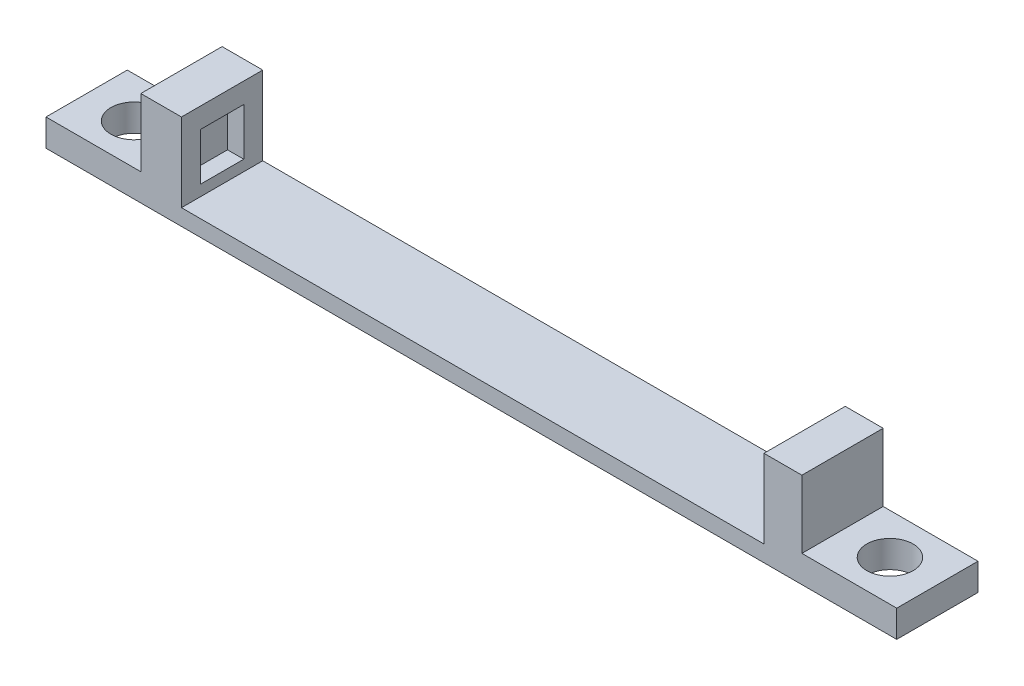
from build123d import *

# Parameters (mm, degrees)
SKETCH1_W           = 79.756
SKETCH1_H           = 7.62
BOSS_EXTRUDE1_DEPTH = 8.89
SKETCH2_W           = 8.89
SKETCH2_H           = 7.62
CUT_EXTRUDE1_DEPTH  = 6.35
SKETCH3_W           = 8.89
SKETCH3_H           = 7.62
CUT_EXTRUDE2_DEPTH  = 6.35
SKETCH4_W           = 54.61
SKETCH4_H           = 7.62
CUT_EXTRUDE3_DEPTH  = 7.366
SKETCH5_W           = 4.064
SKETCH5_H           = 4.445
CUT_EXTRUDE4_DEPTH  = 1.524
SKETCH7_W           = 3.683
SKETCH7_H           = 4.445
BOSS_EXTRUDE2_DEPTH = 1.524
SKETCH8_R           = 2.1717
CUT_EXTRUDE5_DEPTH  = 2.54
SKETCH9_R           = 2.1717
CUT_EXTRUDE6_DEPTH  = 2.54


with BuildPart() as part:
    # Sketch1 → Boss-Extrude1 (new body)
    with BuildSketch(Plane(origin=(0, 0, 0), x_dir=(1, 0, 0), z_dir=(0, 1, 0))):
        with Locations((25.937163647, -9.682646588)):
            Rectangle(SKETCH1_W, SKETCH1_H)
    extrude(amount=BOSS_EXTRUDE1_DEPTH)

    # Sketch2 → Cut-Extrude1 (cut)
    with BuildSketch(Plane(origin=(0, 8.89, 0), x_dir=(1, 0, 0), z_dir=(0, 1, 0))):
        with Locations((-9.495836353, -9.682646588)):
            Rectangle(SKETCH2_W, SKETCH2_H)
    extrude(amount=-CUT_EXTRUDE1_DEPTH, mode=Mode.SUBTRACT)

    # Sketch3 → Cut-Extrude2 (cut)
    with BuildSketch(Plane(origin=(0, 8.89, 0), x_dir=(1, 0, 0), z_dir=(0, 1, 0))):
        with Locations((61.370163647, -9.682646588)):
            Rectangle(SKETCH3_W, SKETCH3_H)
    extrude(amount=-CUT_EXTRUDE2_DEPTH, mode=Mode.SUBTRACT)

    # Sketch4 → Cut-Extrude3 (cut)
    with BuildSketch(Plane(origin=(0, 8.89, 0), x_dir=(1, 0, 0), z_dir=(0, 1, 0))):
        with Locations((26.064163647, -9.682646588)):
            Rectangle(SKETCH4_W, SKETCH4_H)
    extrude(amount=-CUT_EXTRUDE3_DEPTH, mode=Mode.SUBTRACT)

    # Sketch5 → Cut-Extrude4 (cut)
    with BuildSketch(Plane(origin=(-1.240836353, 0, 0), x_dir=(0, 0, -1), z_dir=(1, 0, 0))):
        with Locations((-9.682646588, 4.7625)):
            Rectangle(SKETCH5_W, SKETCH5_H)
    extrude(amount=-CUT_EXTRUDE4_DEPTH, mode=Mode.SUBTRACT)

    # Sketch7 → Boss-Extrude2 (add)
    with BuildSketch(Plane.ZY.offset(-53.369163647)):
        with Locations((9.682646588, 4.7625)):
            Rectangle(SKETCH7_W, SKETCH7_H)
    extrude(amount=BOSS_EXTRUDE2_DEPTH)

    # Sketch8 → Cut-Extrude5 (cut)
    with BuildSketch(Plane(origin=(0, 2.54, 0), x_dir=(1, 0, 0), z_dir=(0, 1, 0))):
        with Locations(Location((-9.495836353, -9.682646588, 0), (0, 0, 270))):
            Circle(SKETCH8_R)
    extrude(amount=-CUT_EXTRUDE5_DEPTH, mode=Mode.SUBTRACT)

    # Sketch9 → Cut-Extrude6 (cut)
    with BuildSketch(Plane(origin=(0, 2.54, 0), x_dir=(1, 0, 0), z_dir=(0, 1, 0))):
        with Locations(Location((61.370163647, -9.682646588, 0), (0, 0, 270))):
            Circle(SKETCH9_R)
    extrude(amount=-CUT_EXTRUDE6_DEPTH, mode=Mode.SUBTRACT)


solid = part.part
